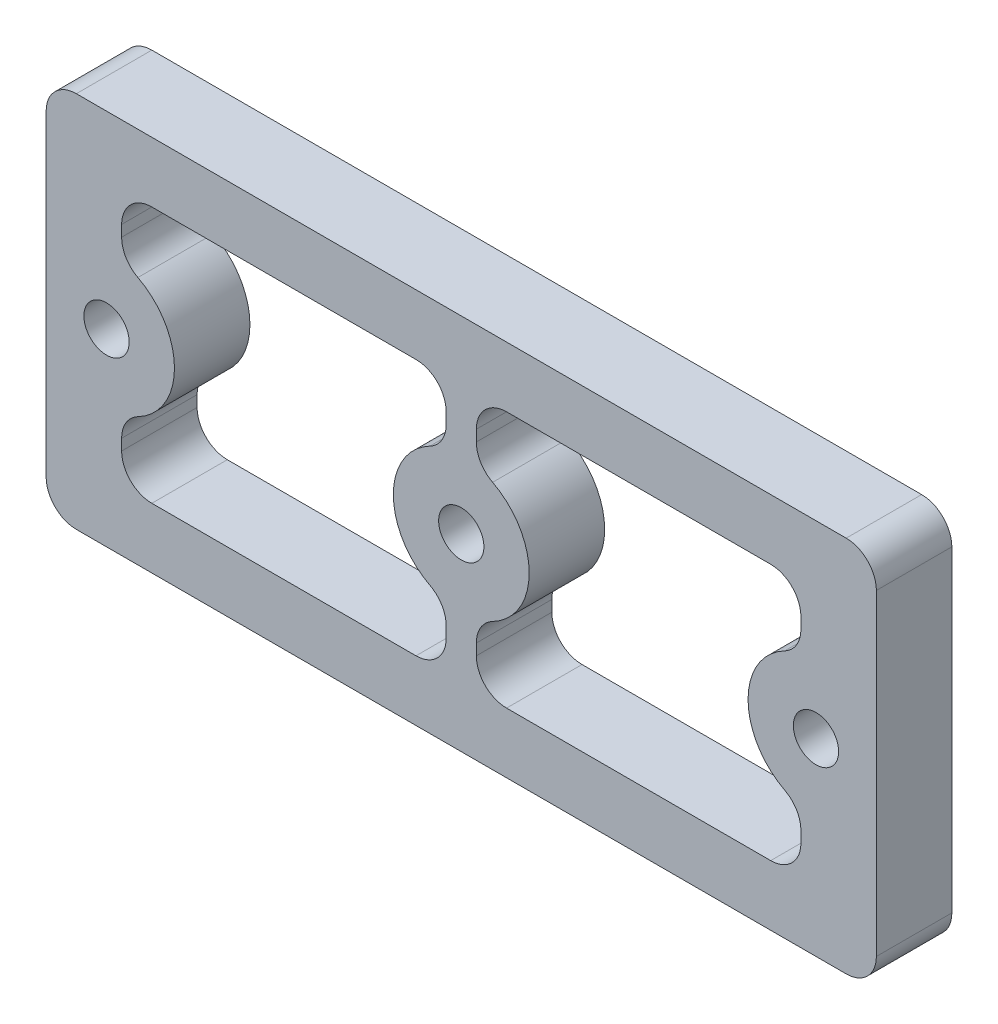
from build123d import *

# Parameters (mm, degrees)
SKETCH_1_W          = 55
SKETCH_1_H          = 25
EXTRUDE_1_DEPTH     = 5
SKETCH_2_R          = 1.5
CUT_EXTRUDE_1_DEPTH = 5
CUT_EXTRUDE_2_DEPTH = 5
FILLET_1_R          = 2
FILLET_2_R          = 2


with BuildPart() as part:
    # 草图1 → 凸台-拉伸1 (new body)
    with BuildSketch(Plane.XY):
        Rectangle(SKETCH_1_W, SKETCH_1_H)
    extrude(amount=EXTRUDE_1_DEPTH)

    # 草图2 → 切除-拉伸1 (cut)
    with BuildSketch(Plane.XY.offset(5)):
        with Locations((-23.5, 0)):
            Circle(SKETCH_2_R)
        Circle(SKETCH_2_R)
        with Locations((23.5, 0)):
            Circle(SKETCH_2_R)
    extrude(amount=-CUT_EXTRUDE_1_DEPTH, mode=Mode.SUBTRACT)

    # 草图3 → 切除-拉伸2 (cut)
    with BuildSketch(Plane.XY.offset(5)):
        with BuildLine():
            Line((-22.5, -4.387482194), (-22.5, -8.5))
            Line((-22.5, -8.5), (-1, -8.5))
            Line((-1, -8.5), (-1, -4.387482194))
            ThreePointArc((-1, -4.387482194), (-4.5, 0), (-1, 4.387482194))
            Line((-1, 4.387482194), (-1, 8.5))
            Line((-1, 8.5), (-22.5, 8.5))
            Line((-22.5, 8.5), (-22.5, 4.387482194))
            ThreePointArc((-22.5, 4.387482194), (-19.98218818, 2.80624304), (-19, 0))
            ThreePointArc((-19, 0), (-19.98218818, -2.80624304), (-22.5, -4.387482194))
        make_face()
    cut_extrude_2 = extrude(amount=-CUT_EXTRUDE_2_DEPTH, mode=Mode.SUBTRACT)

    # 镜向2: 切除-拉伸2 across plane
    add(cut_extrude_2.mirror(Plane(origin=(0, 0, 0), x_dir=(0, 0, 1), z_dir=(1, 0, 0))), mode=Mode.SUBTRACT)

    # 圆角1
    fillet_1_edges = [part.edges().sort_by_distance(p)[0] for p in [
        (-1, 4.387482194, 2.5),
        (-1, -4.387482194, 2.5),
        (-1, -8.5, 2.5),
        (-22.5, -8.5, 2.5),
        (-22.5, -4.387482194, 2.5),
        (-22.5, 4.387482194, 2.5),
        (-22.5, 8.5, 2.5),
        (-1, 8.5, 2.5),
        (1, -4.387482194, 2.5),
        (1, 4.387482194, 2.5),
        (1, 8.5, 2.5),
        (22.5, 8.5, 2.5),
        (22.5, 4.387482194, 2.5),
        (22.5, -4.387482194, 2.5),
        (22.5, -8.5, 2.5),
        (1, -8.5, 2.5),
    ]]
    fillet(fillet_1_edges, radius=FILLET_1_R)

    # 圆角2
    fillet_2_edges = [part.edges().sort_by_distance(p)[0] for p in [
        (27.5, -12.5, 2.5),
        (-27.5, -12.5, 2.5),
        (-27.5, 12.5, 2.5),
        (27.5, 12.5, 2.5),
    ]]
    fillet(fillet_2_edges, radius=FILLET_2_R)


solid = part.part
